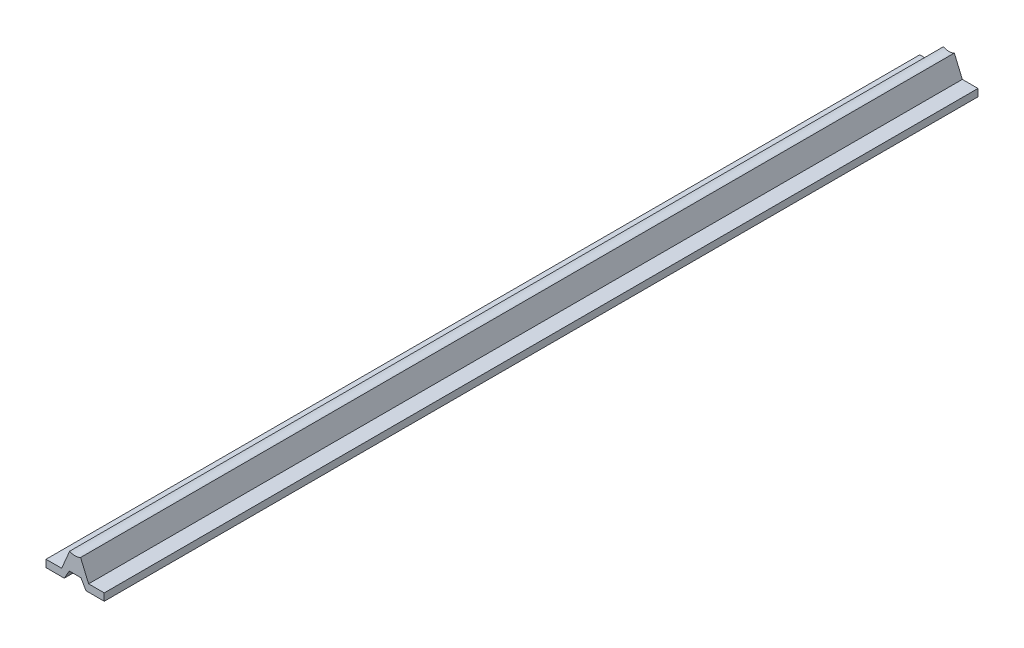
from build123d import *

# Parameters (mm, degrees)
BOSS_EXTRUDE1_DEPTH = 600


with BuildPart() as part:
    # Sketch1 → Boss-Extrude1 (new body)
    with BuildSketch(Plane.XY):
        with BuildLine():
            Line((-20, -25), (-7.464101615, -25))
            Line((-7.464101615, -25), (-4, -19))
            Line((-4, -19), (4, -19))
            Line((4, -19), (7.464101615, -25))
            Line((7.464101615, -25), (20, -25))
            Line((20, -25), (20, -20))
            Line((20, -20), (9.25, -20))
            Line((9.25, -20), (3.75, -7.066647013))
            ThreePointArc((3.75, -7.066647013), (0, -8), (-3.75, -7.066647013))
            Line((-3.75, -7.066647013), (-9.25, -20))
            Line((-9.25, -20), (-20, -20))
            Line((-20, -20), (-20, -25))
        make_face()
    extrude(amount=BOSS_EXTRUDE1_DEPTH)


solid = part.part
